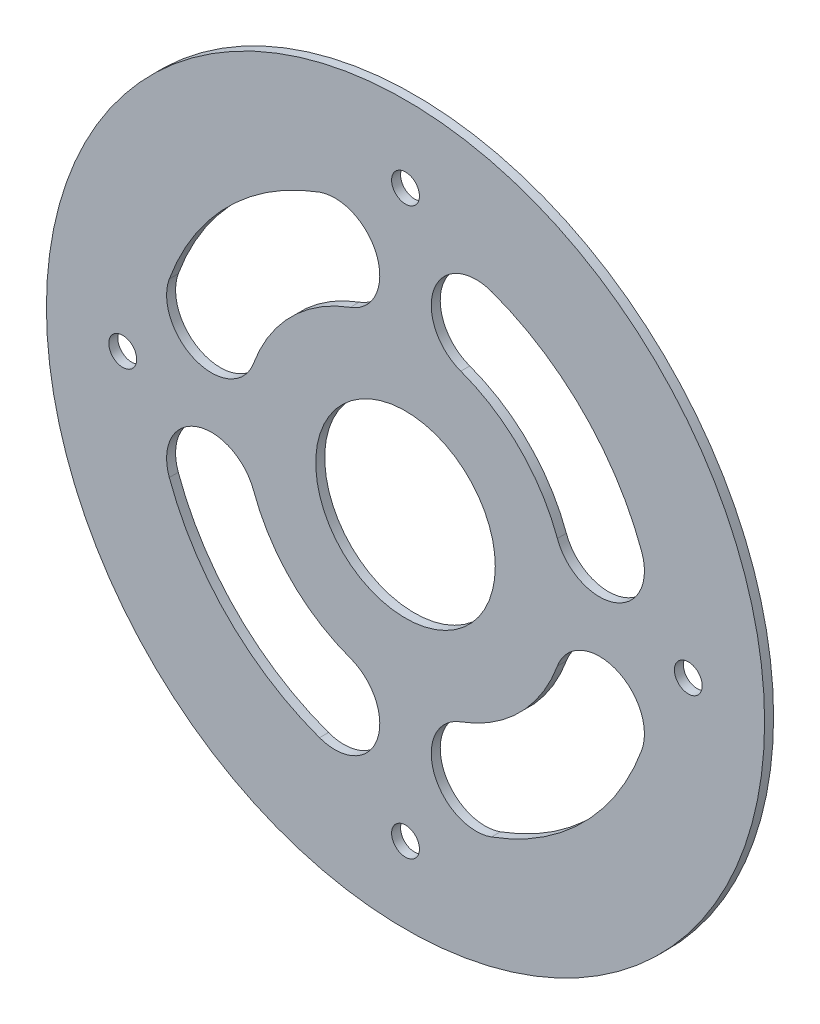
from build123d import *

# Parameters (mm, degrees)
SKETCH_1_R               = 40
EXTRUDE_1_DEPTH          = 1
SKETCH_2_R               = 1.55
CUT_EXTRUDE_1_DEPTH      = 1
SKETCH_4_R               = 10
CUT_EXTRUDE_3_DEPTH      = 1
CUT_EXTRUDE_4_DEPTH      = 1
PATTERN_CIRCULAR_2_COUNT = 4


with BuildPart() as part:
    # 草图1 → 凸台-拉伸1 (new body)
    with BuildSketch(Plane.XY):
        Circle(SKETCH_1_R)
    extrude(amount=EXTRUDE_1_DEPTH)

    # 草图2 → 切除-拉伸1 (cut)
    with BuildSketch(Plane.XY.offset(1)):
        with Locations((0, 31.5)):
            Circle(SKETCH_2_R)
        with Locations((-31.5, 0)):
            Circle(SKETCH_2_R)
        with Locations((0, -31.5)):
            Circle(SKETCH_2_R)
        with Locations((31.5, 0)):
            Circle(SKETCH_2_R)
    extrude(amount=-CUT_EXTRUDE_1_DEPTH, mode=Mode.SUBTRACT)

    # 草图4 → 切除-拉伸3 (cut)
    with BuildSketch(Plane.XY.offset(1)):
        Circle(SKETCH_4_R)
    extrude(amount=-CUT_EXTRUDE_3_DEPTH, mode=Mode.SUBTRACT)

    # 草图5 → 切除-拉伸4 (cut)
    with BuildSketch(Plane.XY.offset(1)):
        with BuildLine():
            ThreePointArc((9.576564013, -26.311393382), (19.798989873, -19.798989873), (26.311393382, -9.576564013))
            ThreePointArc((26.311393382, -9.576564013), (23.323030995, -3.168000193), (16.914467174, -6.15636258))
            ThreePointArc((16.914467174, -6.15636258), (12.727922061, -12.727922061), (6.15636258, -16.914467174))
            ThreePointArc((6.15636258, -16.914467174), (3.168000193, -23.323030995), (9.576564013, -26.311393382))
        make_face()
    cut_extrude_4 = extrude(amount=-CUT_EXTRUDE_4_DEPTH, mode=Mode.SUBTRACT)

    # 阵列(圆周)2: 切除-拉伸4 ×4 about axis
    pattern_circular_2_axis = Axis((0, 0, 0), (0, 0, 1))
    for i in range(1, PATTERN_CIRCULAR_2_COUNT):
        add(cut_extrude_4.rotate(pattern_circular_2_axis, i * 360 / PATTERN_CIRCULAR_2_COUNT), mode=Mode.SUBTRACT)


solid = part.part
